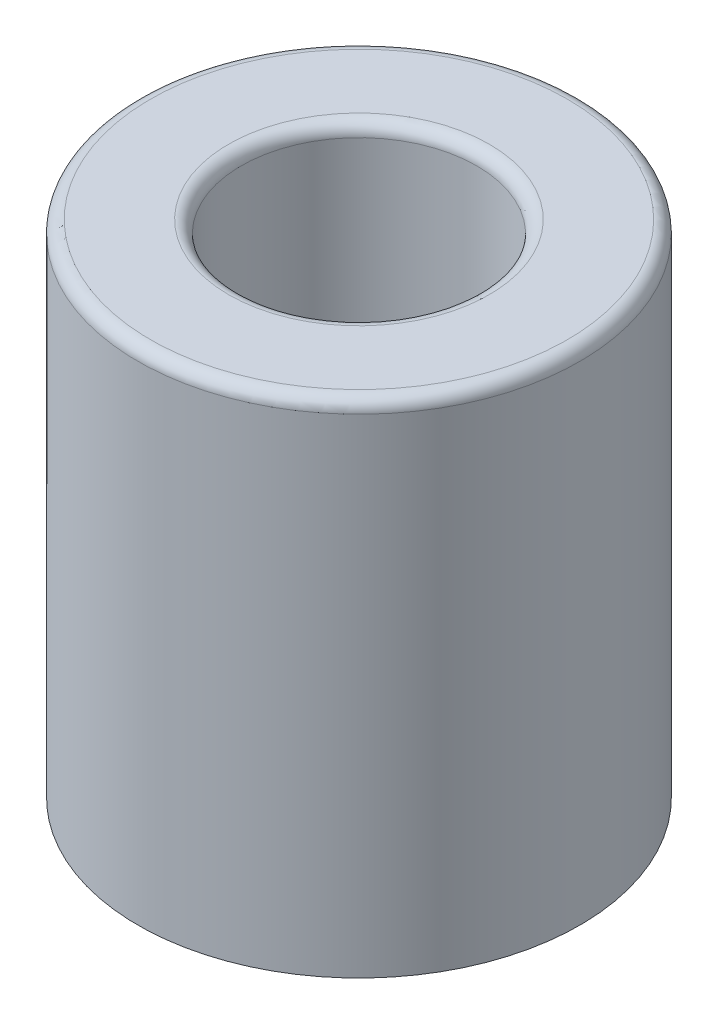
from build123d import *

# Parameters (mm, degrees)
FILLET1_R = 0.33734375


with BuildPart() as part:
    # Sketch2 → Revolve1 (revolve)
    with BuildSketch(Plane.XY):
        with BuildLine():
            Line((-5.953125, 0), (-5.953125, 13.15640625))
            ThreePointArc((-5.953125, 13.15640625), (-5.854319303, 13.394944303), (-5.61578125, 13.49375))
            Line((-5.61578125, 13.49375), (-3.175, 13.49375))
            Line((-3.175, 13.49375), (-3.175, 4.7625))
            Line((-3.175, 4.7625), (-1.7859375, 4.7625))
            Line((-1.7859375, 4.7625), (-1.7859375, 0))
            Line((-1.7859375, 0), (-5.953125, 0))
        make_face()
    revolve(axis=Axis((0, 0, 0), (0, 1, 0)))

    # Fillet1
    fillet1_edges = [part.edges().sort_by_distance(p)[0] for p in [
        (3.175, 13.49375, 0),
    ]]
    fillet(fillet1_edges, radius=FILLET1_R)


solid = part.part
